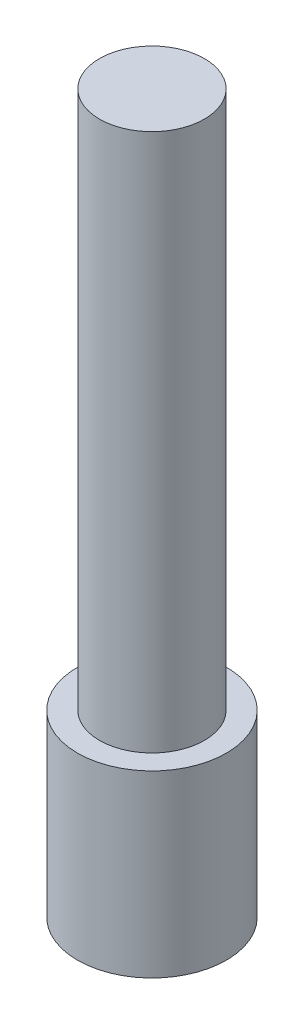
from build123d import *

# Parameters (mm, degrees)
SKETCH2_R           = 2.925
BOSS_EXTRUDE1_DEPTH = 30
SKETCH2_3_R         = 4.15
SKETCH2_3_R_2       = 2.925
BOSS_EXTRUDE2_DEPTH = 10


with BuildPart() as part:
    # Sketch2 → Boss-Extrude1 (new body)
    with BuildSketch(Plane(origin=(0, 0, 0), x_dir=(1, 0, 0), z_dir=(0, 1, 0))):
        Circle(SKETCH2_R)
    extrude(amount=BOSS_EXTRUDE1_DEPTH)


with BuildPart() as body_2:
    # Sketch2<3> → Boss-Extrude2 (new body)
    with BuildSketch(Plane(origin=(0, 0, 0), x_dir=(1, 0, 0), z_dir=(0, 1, 0))):
        Circle(SKETCH2_3_R)
        Circle(SKETCH2_3_R_2, mode=Mode.SUBTRACT)
    extrude(amount=-BOSS_EXTRUDE2_DEPTH)


solid = Compound([part.part, body_2.part])
